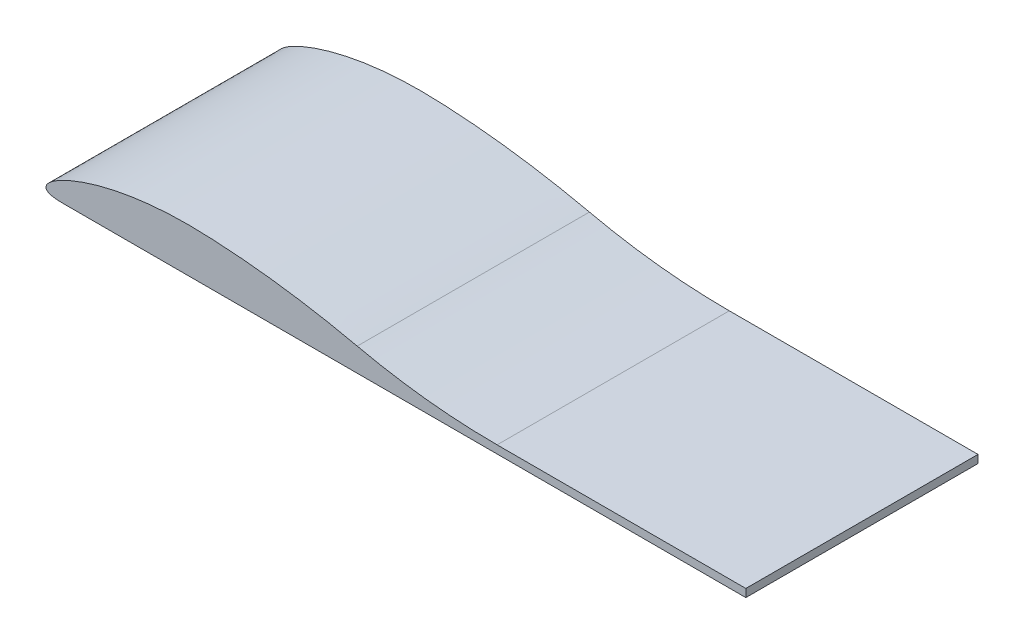
from build123d import *

# Parameters (mm, degrees)
BOSS_EXTRUDE1_DEPTH = 185.42
FILLET1_R           = 508


with BuildPart() as part:
    # Sketch1 → Boss-Extrude1 (new body)
    with BuildSketch(Plane.XY):
        with BuildLine():
            add(Edge.make_bspline(
                [(13.161115253, -3.654646631), (13.823623725, -3.654646631), (16.987832029, -3.616054402), (23.087716531, -3.309495072), (31.861742479, -2.560725044), (41.843709875, -1.536189628), (52.931986121, -0.324549043), (65.008512648, 0.982737613), (77.964122557, 2.277511633), (91.674031486, 3.446601281), (106.020407657, 4.412124839), (120.955345623, 5.051776243), (136.33914131, 5.410297234), (152.00771634, 5.729330171), (167.715786189, 5.891355535), (183.286749283, 5.907819478), (198.553027185, 5.759500833), (213.347799024, 5.457376615), (227.508384674, 5.013382487), (240.87707765, 4.458546495), (253.302348042, 3.819562542), (264.636493621, 3.140644353), (274.759317931, 2.451673351), (283.511762664, 1.803338009), (290.902443864, 1.207394425), (296.53666063, 0.74243374), (301.097723542, 0.310240549), (302.984341567, 0.206591886), (304.793276654, -0.029609745), (304.8, 0)],
                knots=[0.530802003, 0.530802003, 0.530802003, 0.530802003, 0.533991629, 0.546033957, 0.560220284, 0.576403357, 0.594370816, 0.613951104, 0.634916885, 0.657088503, 0.68022991, 0.704175481, 0.729090367, 0.754353776, 0.779667752, 0.80476012, 0.829359339, 0.85320871, 0.876041363, 0.897604065, 0.917662212, 0.93596986, 0.952309788, 0.966502759, 0.978350083, 0.987731492, 0.99451092, 0.998633933, 1, 1, 1, 1], degree=3))
            Line((13.161115253, -3.654646631), (558.8, -3.654646631))
            Line((558.8, -3.654646631), (558.8, 2.695353369))
            Line((558.8, 2.695353369), (295.985175517, 2.695353369))
            add(Edge.make_bspline(
                [(304.8, 0), (304.806765113, 0.029793691), (303.042265442, 0.505757681), (301.260699108, 1.131288287), (298.363634875, 1.98706409), (296.481226949, 2.547598218), (295.985175517, 2.695353369)],
                knots=[0, 0, 0, 0, 0.001374553, 0.005484497, 0.012273361, 0.014741887, 0.014741887, 0.014741887, 0.014741887], degree=3))
        make_face()
        with BuildLine():
            add(Edge.make_bspline(
                [(304.8, 0), (304.806765113, 0.029793691), (303.042265442, 0.505757681), (301.260699108, 1.131288287), (296.859481645, 2.431382143), (291.428347564, 4.059507507), (284.27148123, 6.106238287), (275.759062516, 8.441011906), (265.86759503, 11.013912173), (254.728284103, 13.723951628), (242.452197766, 16.50134202), (229.161916523, 19.249453844), (215.002240334, 21.891859808), (200.122077246, 24.347664434), (184.681833302, 26.544941892), (168.851714948, 28.423390706), (152.808183209, 29.930661937), (136.726583629, 31.004871005), (120.70505044, 31.68890838), (104.913675716, 31.696173318), (89.564892405, 30.886228683), (74.937803443, 29.370910292), (61.220730955, 27.223316908), (48.586751334, 24.554045511), (37.186133391, 21.501101472), (27.155274661, 18.197077887), (18.596928301, 14.804467146), (11.606371729, 11.436038832), (6.205374616, 8.263160289), (2.462071155, 5.310219357), (0.172825892, 2.718078099), (-0.366692026, -0.10672571), (1.618538644, -2.175191533), (4.903129138, -3.111787797), (9.54050067, -3.659044511), (15.622325024, -3.684680114), (23.087716531, -3.309495072), (31.861742479, -2.560725044), (41.843709875, -1.536189628), (52.931986121, -0.324549043), (65.008512648, 0.982737613), (77.964122557, 2.277511633), (91.674031486, 3.446601281), (106.020407657, 4.412124839), (120.955345623, 5.051776243), (136.33914131, 5.410297234), (152.00771634, 5.729330171), (167.715786189, 5.891355535), (183.286749283, 5.907819478), (198.553027185, 5.759500833), (213.347799024, 5.457376615), (227.508384674, 5.013382487), (240.87707765, 4.458546495), (253.302348042, 3.819562542), (264.636493621, 3.140644353), (274.759317931, 2.451673351), (283.511762664, 1.803338009), (290.902443864, 1.207394425), (296.53666063, 0.74243374), (301.097723542, 0.310240549), (302.984341567, 0.206591886), (304.793276654, -0.029609745), (304.8, 0)],
                knots=[0, 0, 0, 0, 0.001374553, 0.005484497, 0.012273361, 0.021682196, 0.033580612, 0.047830743, 0.064305953, 0.082777332, 0.103063756, 0.124929017, 0.148149111, 0.172444695, 0.197572106, 0.223268881, 0.249227775, 0.275186209, 0.300900709, 0.326462938, 0.351222485, 0.374905859, 0.397269706, 0.418072414, 0.437079533, 0.454093094, 0.468919632, 0.481391712, 0.491447127, 0.499023571, 0.504293734, 0.507921918, 0.511539686, 0.516780528, 0.52421649, 0.533991629, 0.546033957, 0.560220284, 0.576403357, 0.594370816, 0.613951104, 0.634916885, 0.657088503, 0.68022991, 0.704175481, 0.729090367, 0.754353776, 0.779667752, 0.80476012, 0.829359339, 0.85320871, 0.876041363, 0.897604065, 0.917662212, 0.93596986, 0.952309788, 0.966502759, 0.978350083, 0.987731492, 0.99451092, 0.998633933, 1, 1, 1, 1], degree=3))
        make_face()
    extrude(amount=BOSS_EXTRUDE1_DEPTH)

    # Fillet1
    fillet1_edges = [part.edges().sort_by_distance(p)[0] for p in [
        (295.985175517, 2.695353369, 92.71),
    ]]
    fillet(fillet1_edges, radius=FILLET1_R)


solid = part.part
